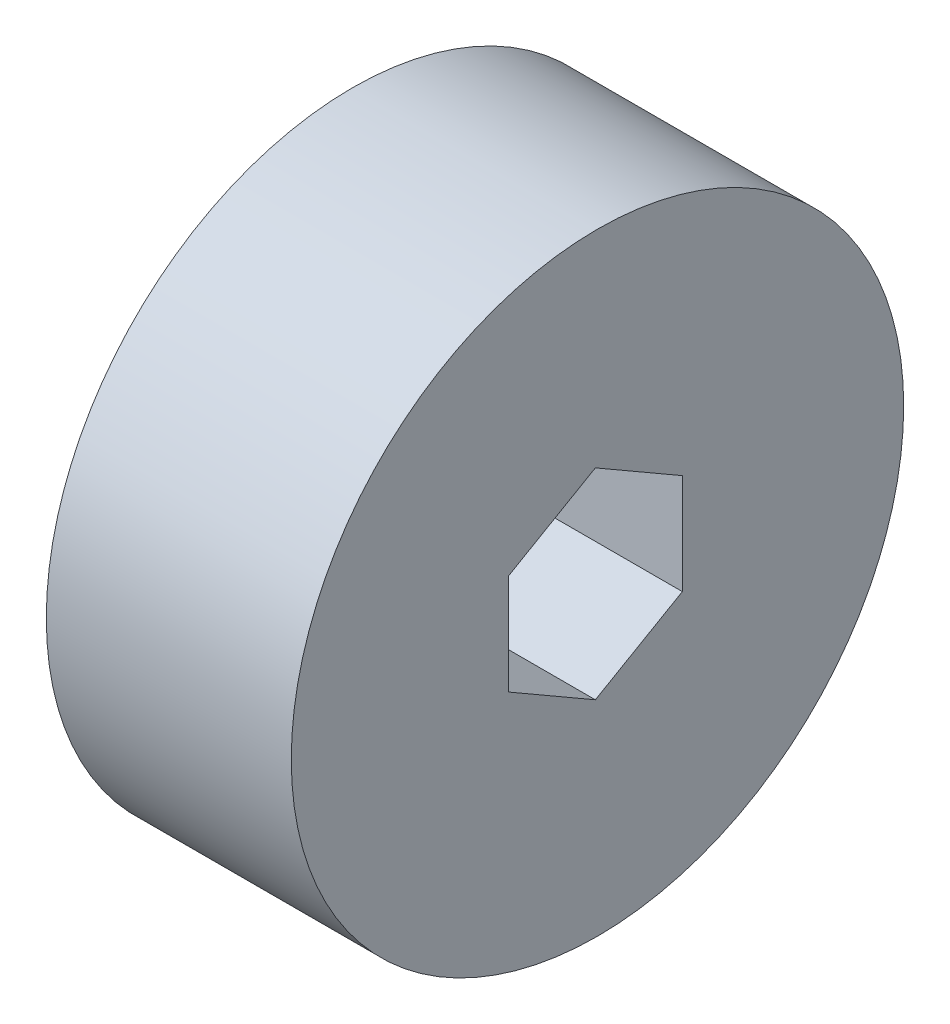
from build123d import *

# Parameters (mm, degrees)
SKETCH1_R           = 12.5
BOSS_EXTRUDE1_DEPTH = 5


with BuildPart() as part:
    # Sketch1 → Boss-Extrude1 (new, symmetric)
    with BuildSketch(Plane(origin=(0, 0, 0), x_dir=(0, 0, -1), z_dir=(1, 0, 0))):
        Circle(SKETCH1_R)
        Polygon((-0.086747097, -4.095153345), (3.463252903, -2.04555989), (3.463252903, 2.053627021), (-0.086747097, 4.103220477), (-3.636747097, 2.053627021), (-3.636747097, -2.04555989), align=None, mode=Mode.SUBTRACT)
    extrude(amount=BOSS_EXTRUDE1_DEPTH, both=True)


solid = part.part
